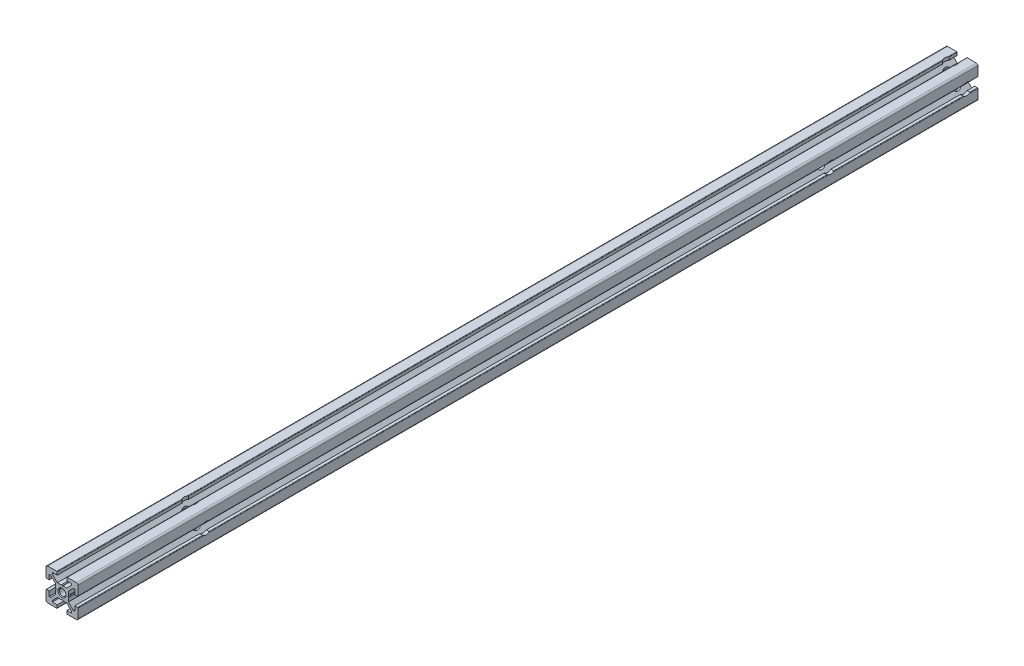
from build123d import *

# Parameters (mm, degrees)
BOSS_EXTRUDE1_DEPTH     = 562
CUT_EXTRUDE1_DEPTH      = 10
CUT_EXTRUDE1_DEPTH_BACK = 10
SKETCH3_R               = 3.675
CUT_EXTRUDE2_DEPTH      = 10
CUT_EXTRUDE2_DEPTH_BACK = 10
SKETCH4_R               = 3.675
CUT_EXTRUDE3_DEPTH      = 10
CUT_EXTRUDE3_DEPTH_BACK = 10
SKETCH5_R               = 3.6751
CUT_EXTRUDE4_DEPTH      = 10
CUT_EXTRUDE4_DEPTH_BACK = 10
SKETCH6_R               = 3.6752
CUT_EXTRUDE5_DEPTH      = 10
CUT_EXTRUDE5_DEPTH_BACK = 10
SKETCH7_R               = 3.6752


with BuildPart() as part:
    # Sketch1 → Boss-Extrude1 (new body)
    with BuildSketch(Plane.XY):
        with BuildLine():
            Line((-10, 9), (-10, 3.29999995))
            ThreePointArc((-10, 3.29999995), (-9.912132049, 3.087867916), (-9.7, 3))
            Line((-9.7, 3), (-8, 3))
            Line((-8, 3), (-8, 6))
            Line((-8, 6), (-7.060677, 6))
            Line((-7.060677, 6), (-4, 2.93932965))
            Line((-4, 2.93932965), (-4, 0.519615242))
            Line((-4, 0.519615242), (-3.699996283, -6.437e-06))
            Line((-3.699996283, -6.437e-06), (-4, -0.519628117))
            Line((-4, -0.519628117), (-4, -2.93933725))
            Line((-4, -2.93933725), (-7.0606695, -6))
            Line((-7.0606695, -6), (-8, -6))
            Line((-8, -6), (-8, -3))
            Line((-8, -3), (-9.7, -3))
            ThreePointArc((-9.7, -3), (-9.912132049, -3.087867916), (-10, -3.29999995))
            Line((-10, -3.29999995), (-10, -9))
            ThreePointArc((-10, -9), (-9.707106781, -9.707106781), (-9, -10))
            Line((-9, -10), (-3.29999995, -10))
            ThreePointArc((-3.29999995, -10), (-3.087867916, -9.912132049), (-3, -9.7))
            Line((-3, -9.7), (-3, -8))
            Line((-3, -8), (-6, -8))
            Line((-6, -8), (-6, -7.0606515))
            Line((-6, -7.0606515), (-2.9393489, -4))
            Line((-2.9393489, -4), (-0.519615242, -4))
            Line((-0.519615242, -4), (6.437e-06, -3.699996283))
            Line((6.437e-06, -3.699996283), (0.519628117, -4))
            Line((0.519628117, -4), (2.9393227, -4))
            Line((2.9393227, -4), (6, -7.060677))
            Line((6, -7.060677), (6, -8))
            Line((6, -8), (3, -8))
            Line((3, -8), (3, -9.7))
            ThreePointArc((3, -9.7), (3.087867916, -9.912132049), (3.29999995, -10))
            Line((3.29999995, -10), (9, -10))
            ThreePointArc((9, -10), (9.707106781, -9.707106781), (10, -9))
            Line((10, -9), (10, -3.29999995))
            ThreePointArc((10, -3.29999995), (9.912132049, -3.087867916), (9.7, -3))
            Line((9.7, -3), (8, -3))
            Line((8, -3), (8, -6))
            Line((8, -6), (7.0606435, -6))
            Line((7.0606435, -6), (4, -2.9393482))
            Line((4, -2.9393482), (4, -0.519615242))
            Line((4, -0.519615242), (3.699996283, 6.437e-06))
            Line((3.699996283, 6.437e-06), (4, 0.519628117))
            Line((4, 0.519628117), (4, 2.9393401))
            Line((4, 2.9393401), (7.060651, 6))
            Line((7.060651, 6), (8, 6))
            Line((8, 6), (8, 3))
            Line((8, 3), (9.7, 3))
            ThreePointArc((9.7, 3), (9.912132049, 3.087867916), (10, 3.29999995))
            Line((10, 3.29999995), (10, 9))
            ThreePointArc((10, 9), (9.707106781, 9.707106781), (9, 10))
            Line((9, 10), (3.29999995, 10))
            ThreePointArc((3.29999995, 10), (3.087867916, 9.912132049), (3, 9.7))
            Line((3, 9.7), (3, 8))
            Line((3, 8), (6, 8))
            Line((6, 8), (6, 7.060669))
            Line((6, 7.060669), (2.9393308, 4))
            Line((2.9393308, 4), (0.519615242, 4))
            Line((0.519615242, 4), (-6.437e-06, 3.699996283))
            Line((-6.437e-06, 3.699996283), (-0.519628117, 4))
            Line((-0.519628117, 4), (-2.93935655, 4))
            Line((-2.93935655, 4), (-6, 7.0606435))
            Line((-6, 7.0606435), (-6, 8))
            Line((-6, 8), (-3, 8))
            Line((-3, 8), (-3, 9.7))
            ThreePointArc((-3, 9.7), (-3.087867966, 9.912132034), (-3.3, 10))
            Line((-3.3, 10), (-9, 10))
            ThreePointArc((-9, 10), (-9.707106781, 9.707106781), (-10, 9))
        make_face()
    extrude(amount=-BOSS_EXTRUDE1_DEPTH)

    # Sketch2 → Cut-Revolve1 (revolve, cut)
    with BuildSketch(Plane(origin=(0, 0, 0), x_dir=(0, 0, -1), z_dir=(1, 0, 0)), mode=Mode.PRIVATE) as cut_revolve1_sk:
        Polygon((0, 0), (0, 2.5), (0.433, 2.067), (562, 2.067), (562, 0), align=None)
    revolve(cut_revolve1_sk.sketch.rotate(Axis((0, 0, -562), (0, 0, 1)), 270), axis=Axis((0, 0, -562), (0, 0, 1)), mode=Mode.SUBTRACT)

    # Sketch3 → Cut-Extrude1 (cut, two sides: drawn at the far end of the back side and taken through both)
    with BuildSketch(Plane(origin=(0, 0, 0), x_dir=(0, 0, -1), z_dir=(1, 0, 0)).offset(-CUT_EXTRUDE1_DEPTH_BACK)):
        with Locations(Location((555, 0, 0), (0, 0, 179.999899635))):
            Circle(SKETCH3_R)
    extrude(amount=CUT_EXTRUDE1_DEPTH + CUT_EXTRUDE1_DEPTH_BACK, mode=Mode.SUBTRACT)

    # Sketch4 → Cut-Extrude2 (cut, two sides: drawn at the far end of the back side and taken through both)
    with BuildSketch(Plane(origin=(0, 0, 0), x_dir=(1, 0, 0), z_dir=(0, 1, 0)).offset(-CUT_EXTRUDE2_DEPTH_BACK)):
        with Locations(Location((0, 555, 0), (0, 0, 89.999899635))):
            Circle(SKETCH4_R)
    extrude(amount=CUT_EXTRUDE2_DEPTH + CUT_EXTRUDE2_DEPTH_BACK, mode=Mode.SUBTRACT)

    # Sketch5 → Cut-Extrude3 (cut, two sides: drawn at the far end of the back side and taken through both)
    with BuildSketch(Plane(origin=(0, 0, 0), x_dir=(0, 0, -1), z_dir=(1, 0, 0)).offset(-CUT_EXTRUDE3_DEPTH_BACK)):
        with Locations(Location((470, 0, 0), (0, 0, 179.999899638))):
            Circle(SKETCH5_R)
    extrude(amount=CUT_EXTRUDE3_DEPTH + CUT_EXTRUDE3_DEPTH_BACK, mode=Mode.SUBTRACT)

    # Sketch6 → Cut-Extrude4 (cut, two sides: drawn at the far end of the back side and taken through both)
    with BuildSketch(Plane(origin=(0, 0, 0), x_dir=(0, 0, -1), z_dir=(1, 0, 0)).offset(-CUT_EXTRUDE4_DEPTH_BACK)):
        with Locations(Location((80, 6.437e-06, 0), (0, 0, 180))):
            Circle(SKETCH6_R)
    extrude(amount=CUT_EXTRUDE4_DEPTH + CUT_EXTRUDE4_DEPTH_BACK, mode=Mode.SUBTRACT)

    # Sketch7 → Cut-Extrude5 (cut, two sides: drawn at the far end of the back side and taken through both)
    with BuildSketch(Plane(origin=(0, 0, 0), x_dir=(1, 0, 0), z_dir=(0, 1, 0)).offset(-CUT_EXTRUDE5_DEPTH_BACK)):
        with Locations(Location((-6.437e-06, 80, 0), (0, 0, 89.999799281))):
            Circle(SKETCH7_R)
    extrude(amount=CUT_EXTRUDE5_DEPTH + CUT_EXTRUDE5_DEPTH_BACK, mode=Mode.SUBTRACT)


solid = part.part
